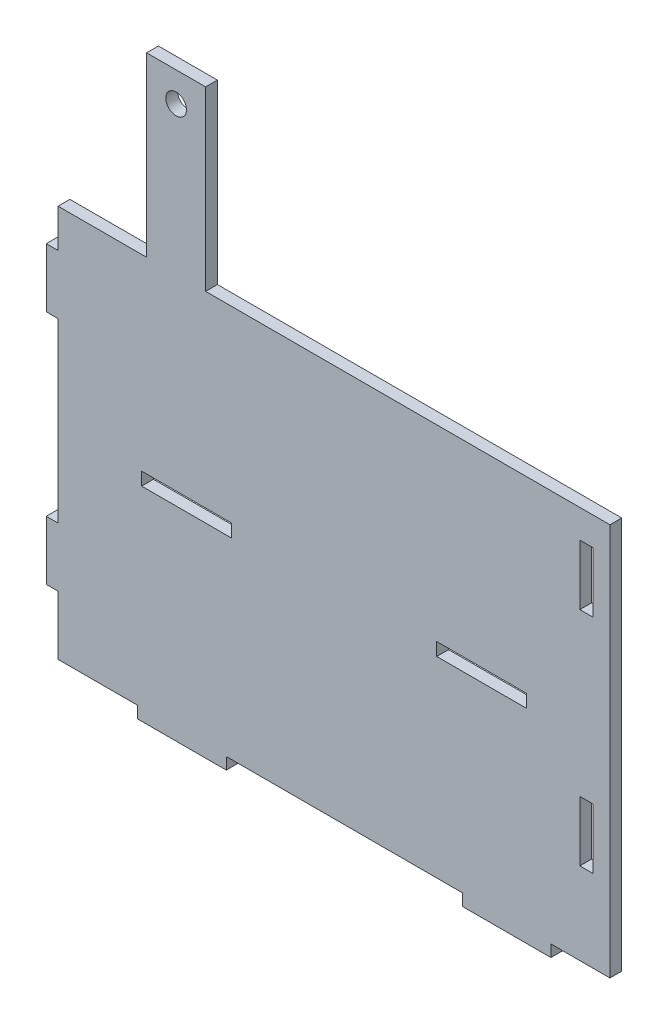
from build123d import *

# Parameters (mm, degrees)
SKETCH_1_W      = 30.4
SKETCH_1_H      = 4.4
SKETCH_1_W_2    = 4.4
SKETCH_1_H_2    = 20.4
SKETCH_1_R      = 3.5
EXTRUDE_1_DEPTH = 4


with BuildPart() as part:
    # Эскиз1 → Бобышка-Вытянуть1 (new body)
    with BuildSketch(Plane.XY):
        Polygon((0, 20), (0, 0), (26.99543951, 0), (26.99543951, -4), (56.99543951, -4), (56.99543951, 0), (136.99543951, 0), (136.99543951, -4), (166.99543951, -4), (166.99543951, 0), (187, 0), (187, 133), (50, 133), (50, 193), (30, 193), (30, 133), (0, 133), (0, 120), (-4, 120), (-4, 100), (0, 100), (0, 40), (-4, 40), (-4, 20), align=None)
        with Locations((43.5, 67.2)):
            Rectangle(SKETCH_1_W, SKETCH_1_H, mode=Mode.SUBTRACT)
        with Locations((179, 38)):
            Rectangle(SKETCH_1_W_2, SKETCH_1_H_2, mode=Mode.SUBTRACT)
        with Locations((143.5, 67.2)):
            Rectangle(SKETCH_1_W, SKETCH_1_H, mode=Mode.SUBTRACT)
        with Locations((179, 113.2)):
            Rectangle(SKETCH_1_W_2, SKETCH_1_H_2, mode=Mode.SUBTRACT)
        with Locations((40, 183)):
            Circle(SKETCH_1_R, mode=Mode.SUBTRACT)
    extrude(amount=EXTRUDE_1_DEPTH)


solid = part.part
